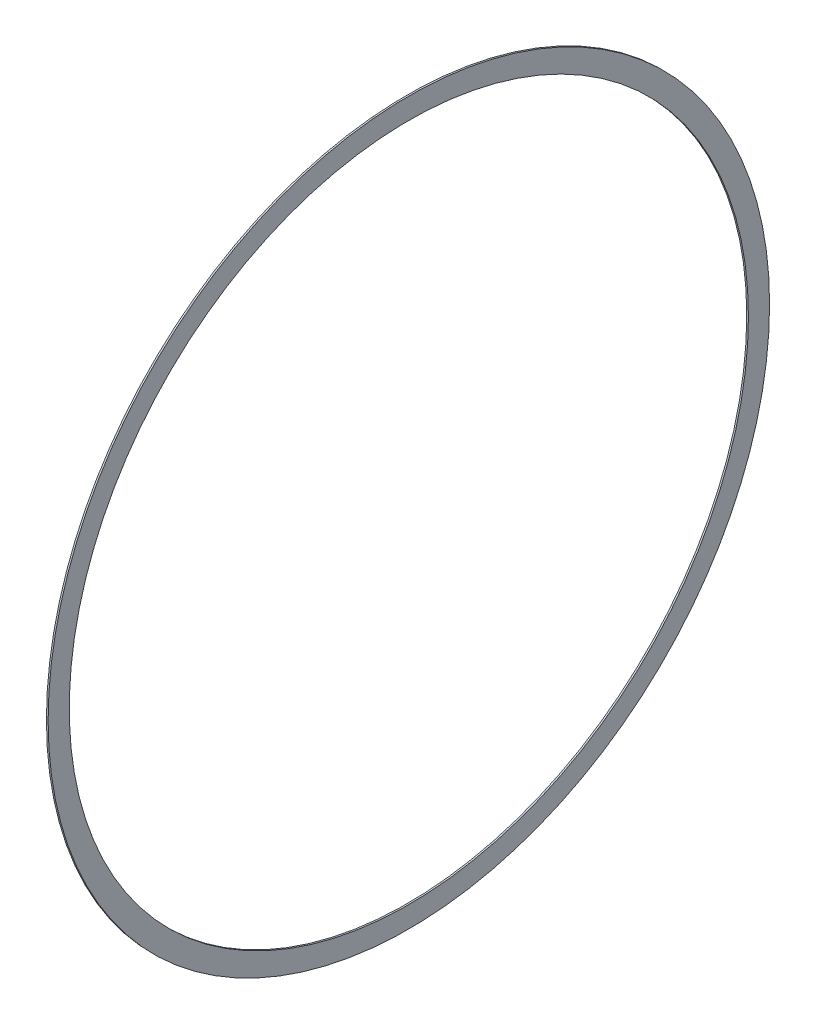
from build123d import *

# Parameters (mm, degrees)
SKETCH1_R           = 853
SKETCH1_R_2         = 803
BOSS_EXTRUDE1_DEPTH = 4


with BuildPart() as part:
    # Sketch1 → Boss-Extrude1 (new body)
    with BuildSketch(Plane(origin=(0, 0, 0), x_dir=(0, 0, -1), z_dir=(1, 0, 0))):
        Circle(SKETCH1_R)
        Circle(SKETCH1_R_2, mode=Mode.SUBTRACT)
    extrude(amount=BOSS_EXTRUDE1_DEPTH)


solid = part.part
